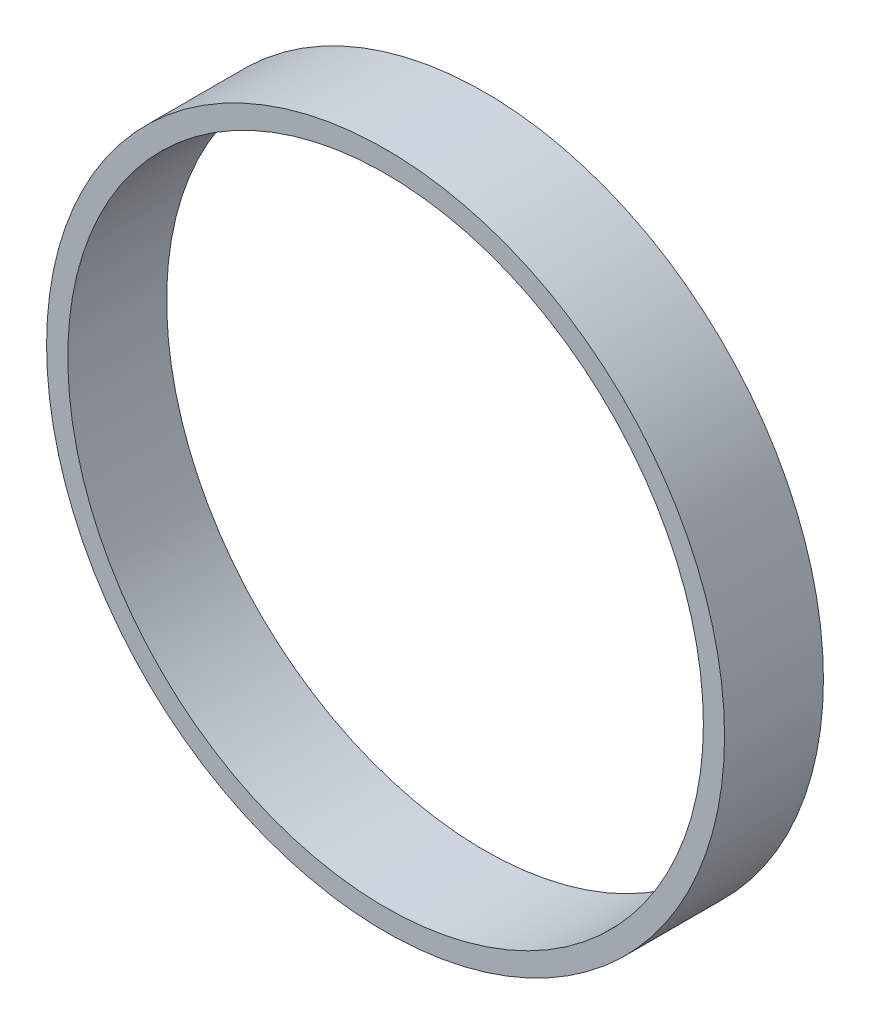
from build123d import *

# Parameters (mm, degrees)
SKETCH1_R           = 24
BOSS_EXTRUDE1_DEPTH = 7
SKETCH2_R           = 22.5
CUT_EXTRUDE1_DEPTH  = 7


with BuildPart() as part:
    # Sketch1 → Boss-Extrude1 (new body)
    with BuildSketch(Plane.XY):
        Circle(SKETCH1_R)
    extrude(amount=BOSS_EXTRUDE1_DEPTH)

    # Sketch2 → Cut-Extrude1 (cut)
    with BuildSketch(Plane.XY.offset(7)):
        Circle(SKETCH2_R)
    extrude(amount=-CUT_EXTRUDE1_DEPTH, mode=Mode.SUBTRACT)


solid = part.part
